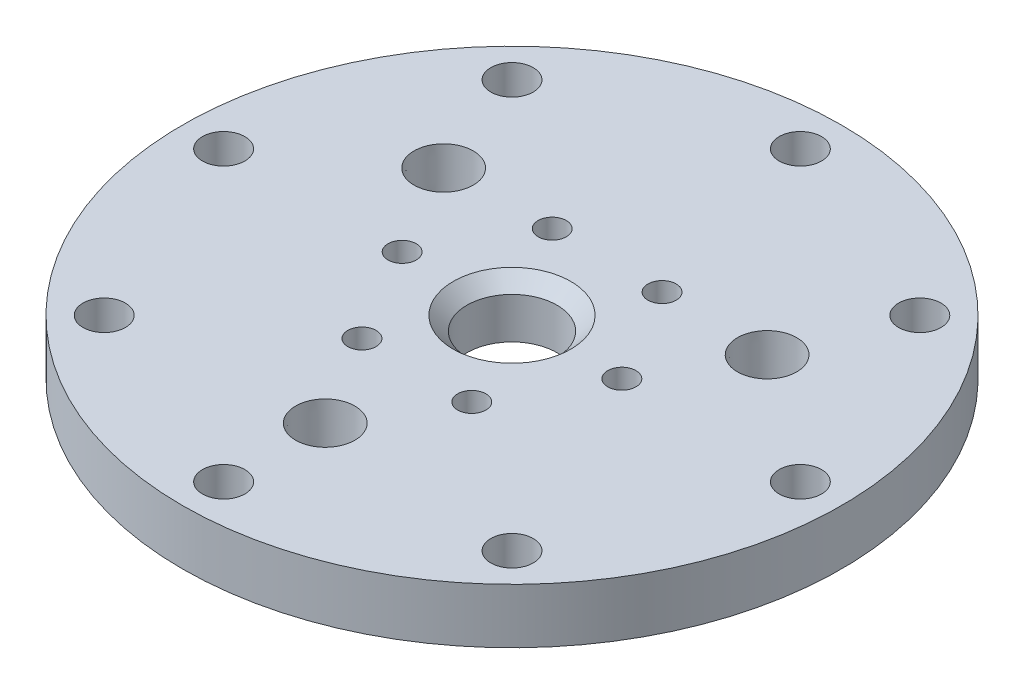
from build123d import *

# Parameters (mm, degrees)
SKETCH1_R                         = 76.2
BOSS_EXTRUDE1_DEPTH               = 12.7
F_3_8_CLEARANCE_HOLE1_D           = 9.8044
F_1_4_CLEARANCE_HOLE1_D           = 6.5278
F_1_4_NPT_TAPPED_HOLE1_AT_2_COUNT = 2
F_1_4_NPT_TAPPED_HOLE1_AT_2_PITCH = 74.789953871
F_1_4_NPT_TAPPED_HOLE1_AT_3_COUNT = 2
F_1_4_NPT_TAPPED_HOLE1_AT_3_PITCH = 74.789953871
SKETCH8_R                         = 10.414
CUT_EXTRUDE1_DEPTH                = 109.508847566
CHAMFER1_SIZE                     = 3.175


with BuildPart() as part:
    # Sketch1 → Boss-Extrude1 (new body)
    with BuildSketch(Plane(origin=(0, 0, 0), x_dir=(1, 0, 0), z_dir=(0, 1, 0))):
        with Locations(Location((0, 0, 0), (0, 0, 270))):
            Circle(SKETCH1_R)
    extrude(amount=BOSS_EXTRUDE1_DEPTH)

    # 3/8 Clearance Hole1 (through all)
    with Locations(Plane(origin=(0, 12.7, 0), x_dir=(1, 0, 0), z_dir=(0, 1, 0))):
        with Locations((47.146344636, -47.146344636), (66.675, 0), (47.146344636, 47.146344636), (0, 66.675), (-47.146344636, 47.146344636), (-66.675, 0), (-47.146344636, -47.146344636), (0, -66.675)):
            Hole(F_3_8_CLEARANCE_HOLE1_D / 2)

    # 1/4 Clearance Hole1 (through all)
    with Locations(Plane(origin=(0, 12.7, 0), x_dir=(1, 0, 0), z_dir=(0, 1, 0))):
        with Locations((12.7, -21.997045256), (25.4, 0), (12.7, 21.997045256), (-12.7, 21.997045256), (-25.4, 0), (-12.7, -21.997045256)):
            Hole(F_1_4_CLEARANCE_HOLE1_D / 2)

    # Sketch7 → 1/4 NPT Tapped Hole1 (revolve, cut)
    with BuildSketch(Plane(origin=(-37.394976935, 12.7, -21.59), x_dir=(0, 0, 1), z_dir=(1, 0, 0))):
        Polygon((0, 0), (0, 12.7), (5.5626, 12.7), (5.5626, 9.906), (6.557984794, 9.906), (6.8545837, 0), align=None)
    f_1_4_npt_tapped_hole1 = revolve(axis=Axis((-37.394976935, 19.05, -21.59), (0, -1, 0)), mode=Mode.SUBTRACT)

    # 1/4 NPT Tapped Hole1 at 2: 1/4 NPT Tapped Hole1 ×2
    with Locations(*[Vector(0.5000000000000003, 0, 0.8660254037844386) * (i * F_1_4_NPT_TAPPED_HOLE1_AT_2_PITCH) for i in range(1, F_1_4_NPT_TAPPED_HOLE1_AT_2_COUNT)]):
        add(f_1_4_npt_tapped_hole1, mode=Mode.SUBTRACT)

    # 1/4 NPT Tapped Hole1 at 3: 1/4 NPT Tapped Hole1 ×2
    with Locations(*[(i * F_1_4_NPT_TAPPED_HOLE1_AT_3_PITCH, 0, 0) for i in range(1, F_1_4_NPT_TAPPED_HOLE1_AT_3_COUNT)]):
        add(f_1_4_npt_tapped_hole1, mode=Mode.SUBTRACT)

    # Sketch8 → Cut-Extrude1 (cut, through all)
    with BuildSketch(Plane(origin=(0, 12.7, 0), x_dir=(1, 0, 0), z_dir=(0, 1, 0))):
        with Locations(Location((0, 0, 0), (0, 0, 270))):
            Circle(SKETCH8_R)
    extrude(amount=-CUT_EXTRUDE1_DEPTH, mode=Mode.SUBTRACT)

    # Chamfer1
    chamfer1_edges = [part.edges().sort_by_distance(p)[0] for p in [
        (0, 12.7, -10.414),
    ]]
    chamfer(chamfer1_edges, length=CHAMFER1_SIZE)


solid = part.part
